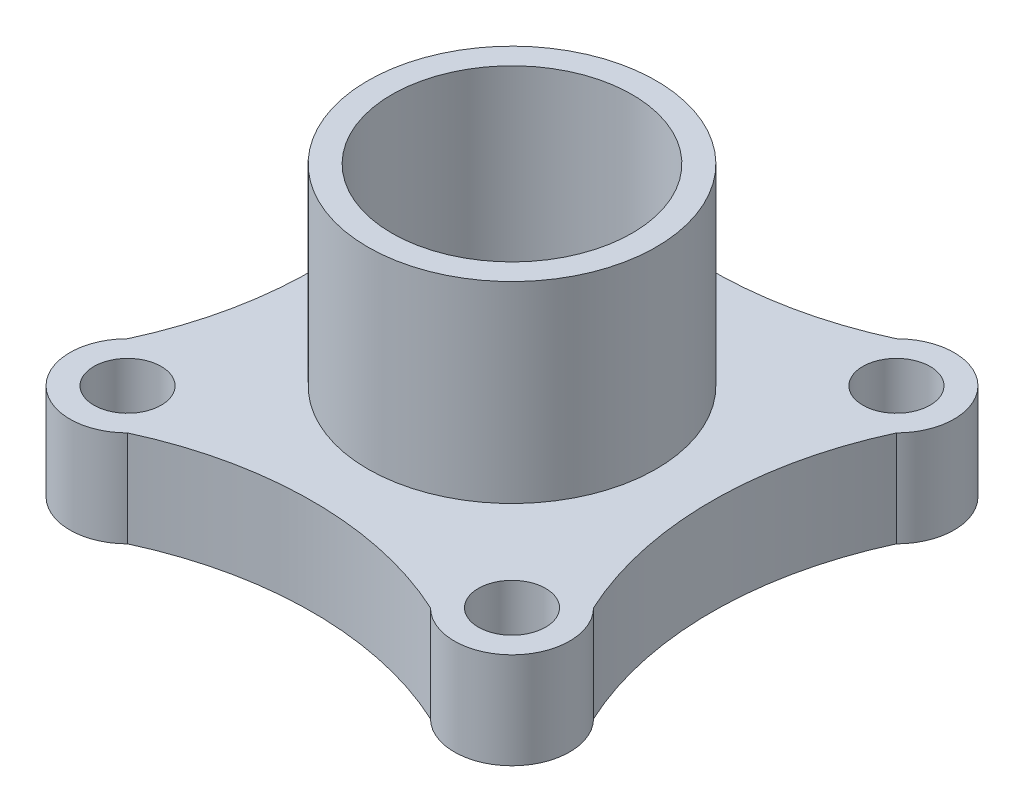
from build123d import *

# Parameters (mm, degrees)
SKETCH1_R           = 30
BOSS_EXTRUDE1_DEPTH = 40
BOSS_EXTRUDE2_DEPTH = 20
SKETCH4_R           = 7
CUT_EXTRUDE2_DEPTH  = 84.713798146
SKETCH2_R           = 25
CUT_EXTRUDE1_DEPTH  = 95.910484142


with BuildPart() as part:
    # Sketch1 → Boss-Extrude1 (new body)
    with BuildSketch(Plane(origin=(0, 0, 0), x_dir=(1, 0, 0), z_dir=(0, 1, 0))):
        with Locations(Location((0, 0, 0), (0, 0, 270))):
            Circle(SKETCH1_R)
    extrude(amount=BOSS_EXTRUDE1_DEPTH)

    # Sketch3 → Boss-Extrude2 (add)
    with BuildSketch(Plane.XZ):
        with BuildLine():
            ThreePointArc((-48.485281374, -31.514718626), (-48.485281374, -48.485281374), (-31.514718626, -48.485281374))
            ThreePointArc((-31.514718626, -48.485281374), (0, -41.542775524), (31.514718626, -48.485281374))
            ThreePointArc((31.514718626, -48.485281374), (48.485281374, -48.485281374), (48.485281374, -31.514718626))
            ThreePointArc((48.485281374, -31.514718626), (41.542775524, 0), (48.485281374, 31.514718626))
            ThreePointArc((48.485281374, 31.514718626), (48.485281374, 48.485281374), (31.514718626, 48.485281374))
            ThreePointArc((31.514718626, 48.485281374), (0, 41.542775524), (-31.514718626, 48.485281374))
            ThreePointArc((-31.514718626, 48.485281374), (-48.485281374, 48.485281374), (-48.485281374, 31.514718626))
            ThreePointArc((-48.485281374, 31.514718626), (-41.542775524, 0), (-48.485281374, -31.514718626))
        make_face()
    extrude(amount=BOSS_EXTRUDE2_DEPTH)

    # Sketch4 → Cut-Extrude2 (cut, through all)
    with BuildSketch(Plane(origin=(0, 0, 0), x_dir=(1, 0, 0), z_dir=(0, 1, 0))):
        with Locations(Location((-40, 40, 0), (0, 0, 270))):
            Circle(SKETCH4_R)
        with Locations(Location((40, -40, 0), (0, 0, 270))):
            Circle(SKETCH4_R)
        with Locations(Location((40, 40, 0), (0, 0, 270))):
            Circle(SKETCH4_R)
        with Locations(Location((-40, -40, 0), (0, 0, 270))):
            Circle(SKETCH4_R)
    extrude(amount=-CUT_EXTRUDE2_DEPTH, mode=Mode.SUBTRACT)

    # Sketch2 → Cut-Extrude1 (cut, through all)
    with BuildSketch(Plane(origin=(0, 40, 0), x_dir=(1, 0, 0), z_dir=(0, 1, 0))):
        with Locations(Location((0, 0, 0), (0, 0, 270))):
            Circle(SKETCH2_R)
    extrude(amount=-CUT_EXTRUDE1_DEPTH, mode=Mode.SUBTRACT)


solid = part.part
